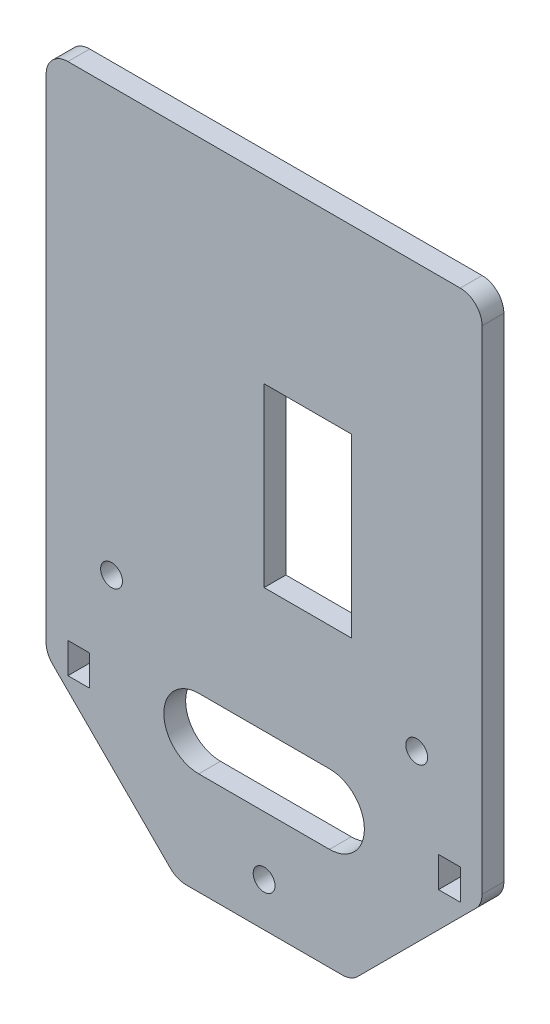
from build123d import *

# Parameters (mm, degrees)
BOSS_EXTRUDE1_DEPTH = 5
SKETCH3_R           = 2.5
SKETCH3_W           = 20
SKETCH3_H           = 40.5
CUT_EXTRUDE3_DEPTH  = 189.745860882
FILLET1_R           = 5
FILLET2_R           = 5
FILLET3_R           = 5
FILLET4_R           = 5
FILLET5_R           = 5
FILLET6_R           = 5
SKETCH4_W           = 5
SKETCH4_H           = 7
CUT_EXTRUDE6_DEPTH  = 189.745860882


with BuildPart() as part:
    # Sketch1 → Boss-Extrude1 (new body)
    with BuildSketch(Plane.XY):
        Polygon((0, 40), (30, 10), (70, 10), (100, 40), (100, 160), (0, 160), align=None)
    extrude(amount=BOSS_EXTRUDE1_DEPTH)

    # Sketch3 → Cut-Extrude3 (cut, through all)
    with BuildSketch(Plane.XY.offset(5)):
        with Locations((50, 20)):
            Circle(SKETCH3_R)
        with Locations((85, 63)):
            Circle(SKETCH3_R)
        with Locations((15, 63)):
            Circle(SKETCH3_R)
        with Locations((60, 98.25)):
            Rectangle(SKETCH3_W, SKETCH3_H)
        with BuildLine():
            Line((35, 49.5), (65, 49.5))
            ThreePointArc((65, 49.5), (73, 41.5), (65, 33.5))
            Line((65, 33.5), (35, 33.5))
            ThreePointArc((35, 33.5), (27, 41.5), (35, 49.5))
        make_face()
    extrude(amount=-CUT_EXTRUDE3_DEPTH, mode=Mode.SUBTRACT)

    # Fillet1
    fillet1_edges = [part.edges().sort_by_distance(p)[0] for p in [
        (0, 40, 2.5),
    ]]
    fillet(fillet1_edges, radius=FILLET1_R)

    # Fillet2
    fillet2_edges = [part.edges().sort_by_distance(p)[0] for p in [
        (100, 40, 2.5),
    ]]
    fillet(fillet2_edges, radius=FILLET2_R)

    # Fillet3
    fillet3_edges = [part.edges().sort_by_distance(p)[0] for p in [
        (70, 10, 2.5),
    ]]
    fillet(fillet3_edges, radius=FILLET3_R)

    # Fillet4
    fillet4_edges = [part.edges().sort_by_distance(p)[0] for p in [
        (30, 10, 2.5),
    ]]
    fillet(fillet4_edges, radius=FILLET4_R)

    # Fillet5
    fillet5_edges = [part.edges().sort_by_distance(p)[0] for p in [
        (100, 160, 2.5),
    ]]
    fillet(fillet5_edges, radius=FILLET5_R)

    # Fillet6
    fillet6_edges = [part.edges().sort_by_distance(p)[0] for p in [
        (0, 160, 2.5),
    ]]
    fillet(fillet6_edges, radius=FILLET6_R)

    # Sketch4 → Cut-Extrude6 (cut, through all)
    with BuildSketch(Plane.XY.offset(5)):
        with Locations((7.5, 41.5)):
            Rectangle(SKETCH4_W, SKETCH4_H)
        with Locations((92.5, 41.5)):
            Rectangle(SKETCH4_W, SKETCH4_H)
    extrude(amount=-CUT_EXTRUDE6_DEPTH, mode=Mode.SUBTRACT)


solid = part.part
